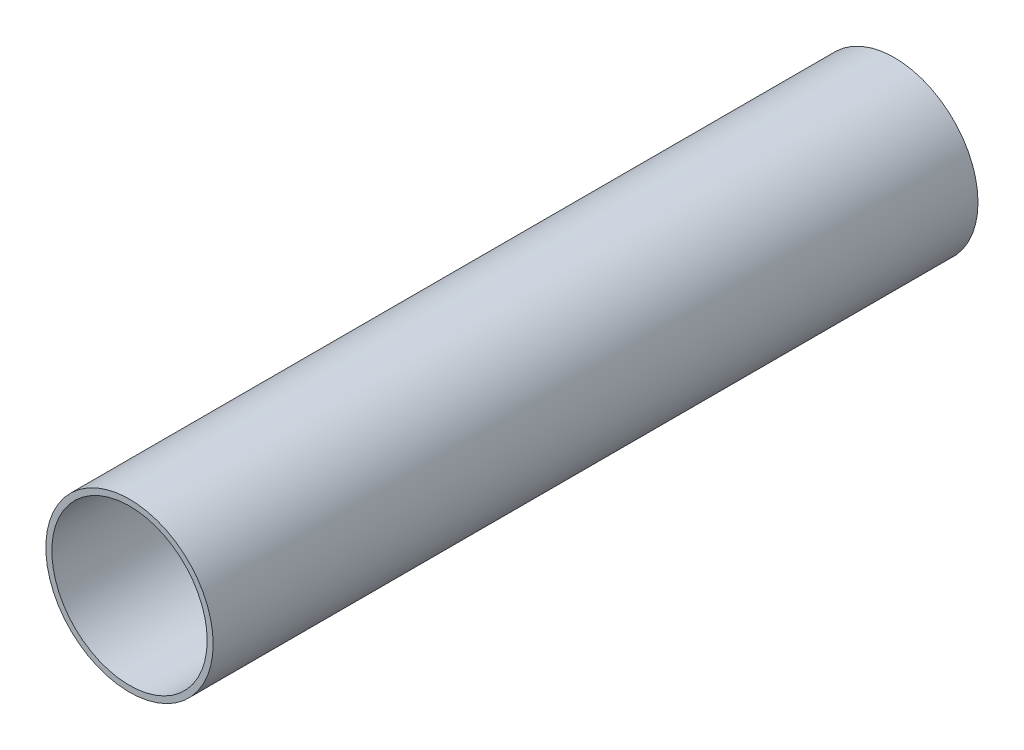
from build123d import *

# Parameters (mm, degrees)
SKETCH1_R           = 22.225
SKETCH1_R_2         = 20.6375
BOSS_EXTRUDE1_DEPTH = 203.2
SCALE1_SCALE        = 0.66


with BuildPart() as part:
    # Sketch1 → Boss-Extrude1 (new body)
    with BuildSketch(Plane.XY):
        Circle(SKETCH1_R)
        Circle(SKETCH1_R_2, mode=Mode.SUBTRACT)
    extrude(amount=BOSS_EXTRUDE1_DEPTH)


with BuildPart() as part_1:
    # Scale1: scaled about (0, 0, 101.6)
    add(part.part.scale(SCALE1_SCALE).moved(Location((0, 0, 34.544))))


solid = part_1.part
